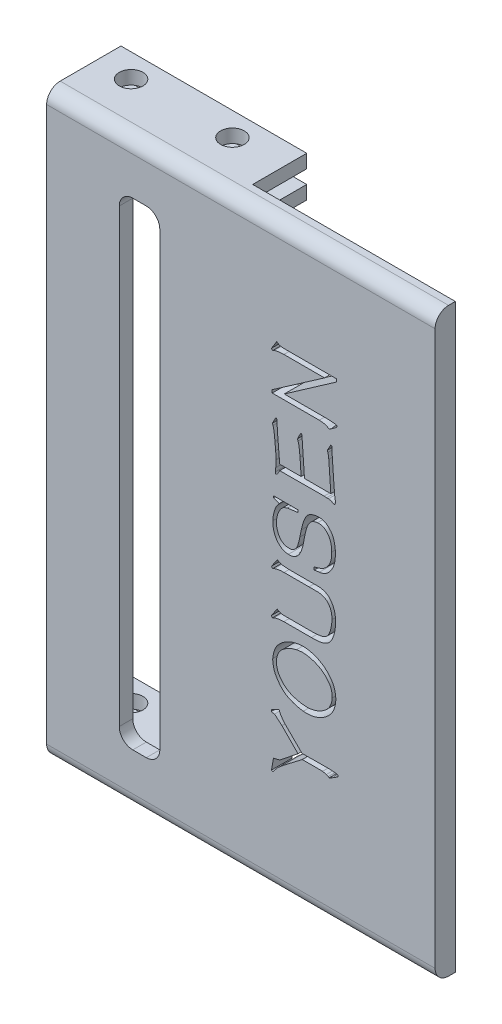
from build123d import *

# Parameters (mm, degrees)
SKETCH_1_W          = 30
SKETCH_1_H          = 11
EXTRUDE_1_DEPTH     = 6
SKETCH_2_W          = 16
SKETCH_2_H          = 2
CUT_EXTRUDE_1_DEPTH = 144
EXTRUDE_2_DEPTH     = 74
SKETCH_4_R          = 1.75
CUT_EXTRUDE_2_DEPTH = 144
SKETCH_5_W          = 11
SKETCH_5_H          = 80
CUT_EXTRUDE_3_DEPTH = 2.5
SKETCH_7_W          = 4
SKETCH_7_H          = 9
CUT_EXTRUDE_4_DEPTH = 74
SKETCH_8_W          = 3
SKETCH_8_H          = 86
EXTRUDE_3_DEPTH     = 30
SKETCH_9_W          = 6
SKETCH_9_H          = 70.729340398
CUT_EXTRUDE_5_DEPTH = 10
FILLET_1_R          = 2
FILLET_2_R          = 2
CUT_EXTRUDE_6_DEPTH = 10


with BuildPart() as part:
    # 草图1 → 凸台-拉伸1 (new body)
    with BuildSketch(Plane(origin=(0, 0, 0), x_dir=(1, 0, 0), z_dir=(0, 1, 0))):
        Rectangle(SKETCH_1_W, SKETCH_1_H)
    extrude_1 = extrude(amount=EXTRUDE_1_DEPTH)

    # 草图2 → 切除-拉伸1 (cut)
    with BuildSketch(Plane.ZY.offset(15)):
        with Locations((-5.5, 3)):
            Rectangle(SKETCH_2_W, SKETCH_2_H)
    cut_extrude_1 = extrude(amount=-CUT_EXTRUDE_1_DEPTH, mode=Mode.SUBTRACT)

    # 草图3 → 凸台-拉伸2 (add)
    with BuildSketch(Plane(origin=(0, 6, 0), x_dir=(1, 0, 0), z_dir=(0, 1, 0))):
        Polygon((2, 5.5), (-2, 5.5), (-2, -3.5), (-15, -3.5), (-15, -5.5), (15, -5.5), (15, -3.5), (2, -3.5), align=None)
    extrude(amount=EXTRUDE_2_DEPTH)

    # 草图4 → 切除-拉伸2 (cut)
    with BuildSketch(Plane(origin=(0, 6, 0), x_dir=(1, 0, 0), z_dir=(0, 1, 0))):
        with Locations(Location((-7.5, 2, 0), (0, 0, 270))):
            Circle(SKETCH_4_R)
        with Locations(Location((7.5, 2, 0), (0, 0, 270))):
            Circle(SKETCH_4_R)
    cut_extrude_2 = extrude(amount=-CUT_EXTRUDE_2_DEPTH, mode=Mode.SUBTRACT)

    # 草图5 → 切除-拉伸3 (cut)
    with BuildSketch(Plane.ZY.offset(15)):
        with Locations((0, 40)):
            Rectangle(SKETCH_5_W, SKETCH_5_H)
    cut_extrude_3 = extrude(amount=-CUT_EXTRUDE_3_DEPTH, mode=Mode.SUBTRACT)

    # 草图7 → 切除-拉伸4 (cut)
    with BuildSketch(Plane(origin=(0, 80, 0), x_dir=(1, 0, 0), z_dir=(0, 1, 0))):
        with Locations((0, 1)):
            Rectangle(SKETCH_7_W, SKETCH_7_H)
    extrude(amount=-CUT_EXTRUDE_4_DEPTH, mode=Mode.SUBTRACT)

    # 镜向1: 凸台-拉伸1, 切除-拉伸1, 切除-拉伸2, 切除-拉伸3 across plane
    add(extrude_1.mirror(Plane.ZX.offset(43)))
    add(cut_extrude_1.mirror(Plane.ZX.offset(43)), mode=Mode.SUBTRACT)
    add(cut_extrude_2.mirror(Plane.ZX.offset(43)), mode=Mode.SUBTRACT)
    add(cut_extrude_3.mirror(Plane.ZX.offset(43)), mode=Mode.SUBTRACT)

    # 草图8 → 凸台-拉伸3 (add)
    with BuildSketch(Plane(origin=(15, 0, 0), x_dir=(0, 0, -1), z_dir=(1, 0, 0))):
        with Locations((-4, 43)):
            Rectangle(SKETCH_8_W, SKETCH_8_H)
    extrude(amount=EXTRUDE_3_DEPTH)

    # 草图9 → 切除-拉伸5 (cut)
    with BuildSketch(Plane(origin=(0, 0, 3.5), x_dir=(-1, 0, 0), z_dir=(0, 0, -1))):
        with Locations((-1.25, 43)):
            Rectangle(SKETCH_9_W, SKETCH_9_H)
    extrude(amount=-CUT_EXTRUDE_5_DEPTH, mode=Mode.SUBTRACT)

    # 圆角1
    fillet_1_edges = [part.edges().sort_by_distance(p)[0] for p in [
        (-1.75, 78.364670199, 4.5),
        (-1.75, 7.635329801, 4.5),
        (4.25, 7.635329801, 4.5),
        (4.25, 78.364670199, 4.5),
    ]]
    fillet(fillet_1_edges, radius=FILLET_1_R)

    # 圆角2
    fillet_2_edges = [part.edges().sort_by_distance(p)[0] for p in [
        (16.25, 86, 5.5),
        (16.25, 0, 5.5),
    ]]
    fillet(fillet_2_edges, radius=FILLET_2_R)

    # 草图10 → 切除-拉伸6 (cut)
    # profile 1 of 6: a face of its own
    with BuildSketch(Plane.XY.offset(5.5)):
        with BuildLine():
            Line((20.923609631, 69.143191988), (20.793628809, 69.4010228))
            Line((20.793628809, 69.4010228), (21.556467079, 70.630513531))
            add(Edge.make_bspline(
                [(21.556467079, 70.630513531), (21.603258715, 70.603029141), (21.694098664, 70.549671729), (21.799421425, 70.469430592), (21.89359644, 70.413054973), (21.982189212, 70.381151779), (22.085649409, 70.349876431), (22.202564606, 70.329798704), (22.319704445, 70.310777676), (22.427850346, 70.298475626), (22.520839812, 70.288521589), (22.57853574, 70.28778512), (22.604836991, 70.287449393)],
                knots=[0, 0, 0, 0, 1.443959229, 2.80326126, 3.523689896, 4.356357707, 5.30232685, 6.400629209, 7.511085781, 8.463841558, 9.299727213, 10, 10, 10, 10], degree=3))
            Line((22.604836991, 70.287449393), (30.386639676, 70.287449393))
            Line((30.386639676, 70.287449393), (30.386639676, 69.859151928))
            Line((30.386639676, 69.859151928), (22.677285319, 64.47879821))
            Line((22.677285319, 64.47879821), (29.22107394, 64.47879821))
            add(Edge.make_bspline(
                [(29.22107394, 64.47879821), (29.27507082, 64.477751018), (29.390251433, 64.475517256), (29.574214632, 64.463787592), (29.779783322, 64.447725955), (29.993145343, 64.42176736), (30.189904536, 64.398780254), (30.338000195, 64.361532134), (30.440067424, 64.337626027), (30.495399702, 64.269623776), (30.469520021, 64.180561088), (30.422605432, 64.081599551), (30.323681546, 63.974210257), (30.236074262, 63.912777441), (30.186341359, 63.87790326)],
                knots=[0, 0, 0, 0, 1.071549029, 2.285718598, 3.657522067, 5.161076859, 6.556356206, 7.568412296, 8.220118684, 8.57247993, 9.168626842, 9.874616694, 10.793462406, 12, 12, 12, 12], degree=3))
            Line((30.186341359, 63.87790326), (29.53856808, 63.421904965))
            add(Edge.make_bspline(
                [(29.53856808, 63.421904965), (29.516064902, 63.40528111), (29.475640145, 63.375417982), (29.417803378, 63.338660651), (29.366609638, 63.320461394), (29.30241827, 63.316342516), (29.215965674, 63.358496474), (29.120434289, 63.411883293), (29.018056539, 63.468403182), (28.914067145, 63.516219277), (28.786848471, 63.560416777), (28.640199318, 63.610787332), (28.473060054, 63.656859807), (28.284186634, 63.684059238), (28.076554126, 63.704513048), (27.931271156, 63.706431975), (27.855209887, 63.707436608)],
                knots=[0, 0, 0, 0, 0.660040725, 1.185698533, 1.609414658, 1.928083271, 2.675051957, 3.799223021, 4.54110446, 5.425469141, 6.495824213, 7.714008071, 9.083117749, 10.575552166, 12.20716875, 14, 14, 14, 14], degree=3))
            Line((27.855209887, 63.707436608), (20.893777967, 63.707436608))
            Line((20.893777967, 63.707436608), (20.893777967, 64.135734072))
            Line((20.893777967, 64.135734072), (28.632963989, 69.51608779))
            Line((28.632963989, 69.51608779), (22.619752823, 69.51608779))
            add(Edge.make_bspline(
                [(22.619752823, 69.51608779), (22.501743733, 69.51440573), (22.26806127, 69.511074901), (21.98280487, 69.48000448), (21.770725587, 69.451735552), (21.635730493, 69.430421784), (21.523295711, 69.409773805), (21.403364307, 69.381874862), (21.269870229, 69.336304879), (21.172989666, 69.284501602), (21.123907948, 69.258256978)],
                knots=[0, 0, 0, 0, 1.848070468, 3.659562632, 4.490512658, 5.20034759, 5.80053293, 6.280969964, 7.129103451, 8, 8, 8, 8], degree=3))
            Line((21.123907948, 69.258256978), (20.923609631, 69.143191988))
        make_face()
    # profile 2 of 6: a face of its own
    with BuildSketch(Plane.XY.offset(5.5)):
        with BuildLine():
            Line((22.001811208, 55.139356488), (25.166098444, 55.139356488))
            Line((25.166098444, 55.139356488), (25.008416791, 57.542936288))
            add(Edge.make_bspline(
                [(25.008416791, 57.542936288), (25.002558438, 57.628926553), (24.989565663, 57.819637517), (24.957134615, 58.114856879), (24.924988635, 58.409963181), (24.887761037, 58.674981617), (24.847978287, 58.903533008), (24.808993318, 59.109462051), (24.764482166, 59.29388896), (24.724462089, 59.406261836), (24.705838483, 59.458555295)],
                knots=[0, 0, 0, 0, 1.063762447, 2.359234061, 3.665312484, 4.727882028, 5.66186734, 6.528447077, 7.315203139, 8, 8, 8, 8], degree=3))
            Line((24.705838483, 59.458555295), (24.633390156, 59.716386107))
            Line((24.633390156, 59.716386107), (25.051033454, 60.545280205))
            add(Edge.make_bspline(
                [(25.051033454, 60.545280205), (25.064088945, 60.566218188), (25.087028841, 60.603008471), (25.122036249, 60.646605882), (25.155045237, 60.672899051), (25.196687841, 60.676154178), (25.239497588, 60.644233412), (25.270576523, 60.583428234), (25.295123494, 60.500813222), (25.29573863, 60.437548045), (25.296079267, 60.402514383)],
                knots=[0, 0, 0, 0, 1.171677453, 2.05876289, 2.66801567, 3.108651998, 3.943333437, 5.003987974, 6.340931338, 8, 8, 8, 8], degree=3))
            Line((25.296079267, 60.402514383), (25.668975069, 55.139356488))
            Line((25.668975069, 55.139356488), (29.566268911, 55.139356488))
            Line((29.566268911, 55.139356488), (29.265821436, 59.4010228))
            add(Edge.make_bspline(
                [(29.265821436, 59.4010228), (29.260420022, 59.467912428), (29.249573754, 59.602229619), (29.21518963, 59.802228589), (29.176852109, 60.003542617), (29.139654948, 60.135679957), (29.120924782, 60.202216066)],
                knots=[0, 0, 0, 0, 0.986759393, 1.981454429, 2.983586542, 4, 4, 4, 4], degree=3))
            Line((29.120924782, 60.202216066), (29.048476454, 60.460046878))
            Line((29.048476454, 60.460046878), (29.495951417, 61.261240145))
            add(Edge.make_bspline(
                [(29.495951417, 61.261240145), (29.509053505, 61.281535774), (29.53202735, 61.317123126), (29.565856912, 61.357597529), (29.599543336, 61.382647363), (29.640382086, 61.373287532), (29.674616477, 61.345492844), (29.702140714, 61.309470024), (29.715775579, 61.269902247), (29.720441277, 61.223694141), (29.72484194, 61.161891008), (29.725636408, 61.114940295), (29.726081398, 61.088642659)],
                knots=[0, 0, 0, 0, 1.417098271, 2.484809728, 3.160089746, 3.710923159, 4.791695792, 5.721562469, 6.344139884, 7.232529516, 8.449907881, 10, 10, 10, 10], degree=3))
            Line((29.726081398, 61.088642659), (29.738866397, 60.660345195))
            add(Edge.make_bspline(
                [(29.738866397, 60.660345195), (29.744301179, 60.539585557), (29.755909219, 60.281657515), (29.779914759, 59.868997791), (29.810277532, 59.405973817), (29.843903673, 58.890940109), (29.884568254, 58.325564053), (29.931478815, 57.709039992), (29.985382372, 57.04219428), (30.022302736, 56.580512758), (30.041444705, 56.341146388)],
                knots=[0, 0, 0, 0, 0.67000843, 1.431057303, 2.291062776, 3.241936932, 4.291812217, 5.432859302, 6.669023727, 8, 8, 8, 8], degree=3))
            Line((30.041444705, 56.341146388), (30.156509695, 55.024291498))
            add(Edge.make_bspline(
                [(30.156509695, 55.024291498), (30.167312854, 54.969630642), (30.187760774, 54.866170083), (30.214542098, 54.718684561), (30.230907581, 54.5869295), (30.245734442, 54.440298814), (30.246602713, 54.28267474), (30.203106798, 54.148064595), (30.149553988, 54.067545672), (30.091556481, 54.038052311), (30.024766425, 54.028399505), (29.980127332, 54.042790558), (29.956211379, 54.050500746)],
                knots=[0, 0, 0, 0, 1.415592265, 2.679393981, 3.807465703, 4.786069614, 6.429066349, 7.764404185, 8.331032004, 8.823567541, 9.369711548, 10, 10, 10, 10], degree=3))
            add(Edge.make_bspline(
                [(29.956211379, 54.050500746), (29.93965655, 54.056444449), (29.890339913, 54.07415067), (29.811045465, 54.128205528), (29.708744803, 54.192376954), (29.579957763, 54.244101588), (29.416716209, 54.283596122), (29.293071612, 54.299228751), (29.22107394, 54.308331558)],
                knots=[0, 0, 0, 0, 0.400502326, 1.193091618, 2.174787829, 3.156484041, 4.344233903, 6, 6, 6, 6], degree=3))
            Line((29.22107394, 54.308331558), (28.948327296, 54.308331558))
            add(Edge.make_bspline(
                [(28.948327296, 54.308331558), (28.908539042, 54.31244042), (28.835359752, 54.319997515), (28.736178254, 54.332363266), (28.65571391, 54.335953009), (28.608814028, 54.337488752), (28.588216493, 54.338163222)],
                knots=[0, 0, 0, 0, 1.327867894, 2.442239059, 3.315861034, 4, 4, 4, 4], degree=3))
            Line((28.588216493, 54.338163222), (22.001811208, 54.308331558))
            add(Edge.make_bspline(
                [(22.001811208, 54.308331558), (21.968452861, 54.251493204), (21.901243824, 54.136977604), (21.804065964, 53.972419745), (21.716401896, 53.827663172), (21.642541534, 53.716612644), (21.578975732, 53.639909011), (21.509504489, 53.603111582), (21.450672022, 53.601695497), (21.399696481, 53.597643049), (21.37359306, 53.634309729), (21.367516052, 53.684382469), (21.362742814, 53.758519583), (21.366691303, 53.816805177), (21.368953761, 53.850202429)],
                knots=[0, 0, 0, 0, 1.929088606, 3.8866491, 5.594679263, 6.880700987, 7.792666375, 8.490018427, 9.075498901, 9.557743041, 9.823998025, 10.293064845, 11.021937678, 12, 12, 12, 12], degree=3))
            Line((21.368953761, 53.850202429), (21.411570424, 54.395695717))
            add(Edge.make_bspline(
                [(21.411570424, 54.395695717), (21.41591824, 54.458905652), (21.424124318, 54.578208226), (21.434357361, 54.745851724), (21.444130983, 54.892094522), (21.448375503, 55.049097301), (21.45347358, 55.205594289), (21.444951931, 55.319786754), (21.441402088, 55.367355636)],
                knots=[0, 0, 0, 0, 1.172075672, 2.212178238, 3.107213123, 3.882892712, 5.118081668, 6, 6, 6, 6], degree=3))
            Line((21.441402088, 55.367355636), (21.441402088, 55.452588962))
            add(Edge.make_bspline(
                [(21.441402088, 55.452588962), (21.441050192, 55.561268252), (21.440385429, 55.766572791), (21.433965929, 56.059245176), (21.42356146, 56.323207524), (21.405350341, 56.489663399), (21.396654592, 56.569145536)],
                knots=[0, 0, 0, 0, 1.166357934, 2.203350603, 3.142105787, 4, 4, 4, 4], degree=3))
            Line((21.396654592, 56.569145536), (21.296505434, 57.68570211))
            add(Edge.make_bspline(
                [(21.296505434, 57.68570211), (21.292335326, 57.743951906), (21.284399666, 57.854800482), (21.271800378, 58.011082266), (21.25929242, 58.148211111), (21.240754929, 58.309994905), (21.220548585, 58.516651707), (21.181187841, 58.772598868), (21.142950324, 59.029707156), (21.096905838, 59.259338942), (21.058879546, 59.447751455), (21.023818061, 59.555360318), (21.008842958, 59.601321117)],
                knots=[0, 0, 0, 0, 0.902698862, 1.717823745, 2.423571822, 3.031008779, 4.234968865, 5.632389185, 7.033083569, 8.251820998, 9.253335651, 10, 10, 10, 10], degree=3))
            Line((21.008842958, 59.601321117), (20.923609631, 59.859151928))
            Line((20.923609631, 59.859151928), (21.354037929, 60.688046026))
            add(Edge.make_bspline(
                [(21.354037929, 60.688046026), (21.367092961, 60.705469869), (21.39040149, 60.736578499), (21.426583036, 60.772737787), (21.455806248, 60.796345395), (21.48986503, 60.807599967), (21.53300314, 60.784468782), (21.557743841, 60.724257521), (21.583640213, 60.643933662), (21.583979839, 60.580440252), (21.58416791, 60.545280205)],
                knots=[0, 0, 0, 0, 1.104947442, 1.972779611, 2.593816905, 3.005386707, 3.716416319, 4.799929555, 6.227932149, 8, 8, 8, 8], degree=3))
            Line((21.58416791, 60.545280205), (21.613999574, 60.089281909))
            add(Edge.make_bspline(
                [(21.613999574, 60.089281909), (21.619959672, 59.990524192), (21.63115419, 59.805033118), (21.653264781, 59.545407329), (21.662931911, 59.322043253), (21.678613954, 59.135508573), (21.683948174, 58.985358734), (21.69605164, 58.872030034), (21.6961133, 58.795114728), (21.698431533, 58.756086602), (21.6992329, 58.742595355)],
                knots=[0, 0, 0, 0, 1.759547492, 3.304859231, 4.633400162, 5.73500885, 6.633314684, 7.304723391, 7.759656695, 8, 8, 8, 8], degree=3))
            Line((21.6992329, 58.742595355), (22.001811208, 55.139356488))
        make_face()
    # profile 3 of 6: a face of its own
    with BuildSketch(Plane.XY.offset(5.5)):
        with BuildLine():
            Line((21.944278713, 50.063711911), (21.066375453, 50.351374387))
            Line((21.066375453, 50.351374387), (21.081291285, 50.63690603))
            Line((21.081291285, 50.63690603), (24.676006819, 50.63690603))
            Line((24.676006819, 50.63690603), (24.690922651, 50.293841892))
            Line((24.690922651, 50.293841892), (23.167376944, 50.093543576))
            add(Edge.make_bspline(
                [(23.167376944, 50.093543576), (23.082393821, 50.065706597), (22.923913881, 50.013795082), (22.709564926, 49.922700147), (22.535427697, 49.827888071), (22.395527644, 49.726597864), (22.284296585, 49.610388962), (22.176519077, 49.487279048), (22.074472717, 49.345678645), (21.977511216, 49.187702831), (21.882371067, 49.016379659), (21.800967235, 48.825955873), (21.72037137, 48.622480929), (21.631639981, 48.326573751), (21.543833252, 47.938809117), (21.522471224, 47.620194511), (21.511719582, 47.459833795)],
                knots=[0, 0, 0, 0, 1.121549844, 2.091511183, 2.917185958, 3.605104007, 4.247789873, 4.930145152, 5.657339825, 6.433750816, 7.25513509, 8.112836821, 9.029603893, 9.999196791, 11.986370824, 14, 14, 14, 14], degree=3))
            add(Edge.make_bspline(
                [(21.511719582, 47.459833795), (21.514107539, 47.363198237), (21.518948639, 47.167289097), (21.543385267, 46.918359138), (21.585726913, 46.708968566), (21.635719776, 46.534081562), (21.702345872, 46.342963403), (21.781970854, 46.140766984), (21.879478494, 45.944009907), (21.988077265, 45.762246566), (22.10874723, 45.604716291), (22.240033727, 45.471323513), (22.376635932, 45.361303244), (22.51281973, 45.269275073), (22.647955435, 45.195316782), (22.786108408, 45.140312699), (22.934505821, 45.102102752), (23.097522436, 45.072081631), (23.280800255, 45.055493691), (23.47748111, 45.0386374), (23.684414105, 45.050019003), (23.886401585, 45.112323701), (24.078580743, 45.218692968), (24.188537084, 45.319382931), (24.245578521, 45.371617302)],
                knots=[0, 0, 0, 0, 1.459173037, 2.958179576, 3.76774155, 4.680873248, 5.701489889, 6.82243581, 7.958863455, 9.012511816, 10.014026446, 10.946591305, 11.830747586, 12.657452482, 13.425028708, 14.151753666, 14.895598774, 15.734725641, 16.65118754, 17.671804181, 18.714539863, 19.755896519, 20.835838952, 22, 22, 22, 22], degree=3))
            add(Edge.make_bspline(
                [(24.245578521, 45.371617302), (24.301744128, 45.43243705), (24.41607532, 45.556242252), (24.550376956, 45.779239287), (24.667732875, 46.026846478), (24.750460904, 46.300908539), (24.821819345, 46.574754085), (24.883205511, 46.834500533), (24.937985242, 47.069027869), (24.965608525, 47.21894194), (24.978585127, 47.289367143)],
                knots=[0, 0, 0, 0, 0.951320796, 1.936516809, 2.983378994, 4.101119546, 5.226321135, 6.244331444, 7.175238766, 8, 8, 8, 8], degree=3))
            Line((24.978585127, 47.289367143), (25.181014277, 48.290858726))
            add(Edge.make_bspline(
                [(25.181014277, 48.290858726), (25.209510455, 48.413890714), (25.264014204, 48.649210152), (25.352051043, 48.984383674), (25.437427958, 49.286508312), (25.527939908, 49.555682141), (25.620813055, 49.79716816), (25.714577402, 50.016946161), (25.818214396, 50.212768679), (25.922186499, 50.390277156), (26.034619318, 50.5474125), (26.159516935, 50.682053603), (26.292101205, 50.799327673), (26.484399809, 50.926053227), (26.742427599, 51.051325024), (27.076092808, 51.159865207), (27.439261269, 51.226223811), (27.761514918, 51.25323462), (28.030940179, 51.251147653), (28.2327959, 51.221436579), (28.430831805, 51.174995432), (28.555467489, 51.121763419), (28.618048157, 51.095035159)],
                knots=[0, 0, 0, 0, 1.450366521, 2.774070724, 3.97977706, 5.055505924, 6.034186978, 6.951116498, 7.797628348, 8.576887578, 9.312796996, 10.011361253, 10.682077562, 11.340476915, 12.6502067, 13.963285664, 15.35841222, 16.880662764, 17.672123816, 18.446242192, 19.219844604, 20, 20, 20, 20], degree=3))
            add(Edge.make_bspline(
                [(28.618048157, 51.095035159), (28.684268101, 51.064698195), (28.817386349, 51.003713495), (29.001707653, 50.882317607), (29.177196092, 50.742467897), (29.337234552, 50.582134401), (29.483747618, 50.413084791), (29.617642735, 50.245396293), (29.730032669, 50.076296191), (29.829421172, 49.906395756), (29.914921915, 49.723152742), (29.990981794, 49.517733673), (30.060185259, 49.285464444), (30.12478039, 49.027739104), (30.176559273, 48.745904255), (30.218983513, 48.441854547), (30.237874119, 48.115657648), (30.241833385, 47.890985439), (30.243873855, 47.775197102)],
                knots=[0, 0, 0, 0, 0.891741816, 1.792618663, 2.696897356, 3.638912313, 4.564486665, 5.438886447, 6.267203075, 7.051274704, 7.849765819, 8.742484793, 9.734097487, 10.819551853, 11.997873062, 13.245295847, 14.580320138, 16, 16, 16, 16], degree=3))
            add(Edge.make_bspline(
                [(30.243873855, 47.775197102), (30.24339063, 47.645174408), (30.242449153, 47.391848827), (30.213615347, 47.021846124), (30.155452214, 46.673696146), (30.075031256, 46.346577587), (29.971365197, 46.041150165), (29.853471246, 45.75437828), (29.713318017, 45.488301565), (29.557405273, 45.242422508), (29.384264405, 45.018908126), (29.194433857, 44.821234972), (28.985957416, 44.652461261), (28.766023249, 44.509884374), (28.53880703, 44.398637136), (28.313779065, 44.311918516), (28.091558985, 44.252229762), (27.942878881, 44.235531034), (27.870125719, 44.227359898)],
                knots=[0, 0, 0, 0, 1.328708624, 2.588747203, 3.788207092, 4.932691089, 6.027755457, 7.082091847, 8.098479613, 9.097371676, 10.054362371, 10.983635839, 11.891827449, 12.789952854, 13.656814164, 14.47252458, 15.252565316, 16, 16, 16, 16], degree=3))
            Line((27.870125719, 44.227359898), (27.107287449, 44.11442574))
            Line((27.107287449, 44.11442574), (27.107287449, 44.512891541))
            add(Edge.make_bspline(
                [(27.107287449, 44.512891541), (27.197618168, 44.536574991), (27.372514296, 44.582430309), (27.623586016, 44.656377581), (27.853952023, 44.734109394), (28.067910231, 44.809855916), (28.266480793, 44.894748787), (28.450889822, 44.995915965), (28.623233364, 45.110920335), (28.786059047, 45.240353243), (28.936797088, 45.387837737), (29.079178946, 45.553098736), (29.208618918, 45.739364885), (29.326381299, 45.943008161), (29.432517634, 46.156479344), (29.517324681, 46.378186901), (29.586918612, 46.602086871), (29.649364505, 46.903335914), (29.696791705, 47.275765223), (29.696427616, 47.572627426), (29.696249734, 47.717664607)],
                knots=[0, 0, 0, 0, 1.10367521, 2.136908949, 3.092581466, 3.976901347, 4.819056112, 5.641782223, 6.459007961, 7.265295195, 8.0964156, 8.947766784, 9.839743601, 10.772729839, 11.726335396, 12.653905287, 13.575377191, 14.494130149, 16.287146445, 18, 18, 18, 18], degree=3))
            add(Edge.make_bspline(
                [(29.696249734, 47.717664607), (29.693886127, 47.845614732), (29.689358676, 48.09070122), (29.652839941, 48.441214442), (29.595489285, 48.758618439), (29.509172179, 49.043140353), (29.401314546, 49.298362783), (29.278261453, 49.53074598), (29.134755875, 49.738413139), (28.976259262, 49.920264977), (28.81025625, 50.073424795), (28.650612866, 50.20403976), (28.490274709, 50.298725261), (28.332990325, 50.367837856), (28.16964573, 50.410781674), (27.99593935, 50.435140983), (27.807672178, 50.446683353), (27.677634063, 50.440049614), (27.610164074, 50.436607714)],
                knots=[0, 0, 0, 0, 1.577169719, 3.021044242, 4.340099201, 5.547956709, 6.678312898, 7.751845845, 8.784229068, 9.783508512, 10.719053536, 11.567010056, 12.320942599, 13.007419184, 13.678702228, 14.395776558, 15.167652216, 16, 16, 16, 16], degree=3))
            add(Edge.make_bspline(
                [(27.610164074, 50.436607714), (27.504483027, 50.420109382), (27.305268269, 50.389009092), (27.030959637, 50.304321298), (26.800240889, 50.19010999), (26.613243125, 50.041979768), (26.461637332, 49.86789839), (26.324122111, 49.677630873), (26.203091997, 49.464732238), (26.093375084, 49.229613765), (25.994664397, 48.965035102), (25.905228848, 48.666863818), (25.816691381, 48.33392238), (25.767282924, 48.09863877), (25.741423397, 47.975495419)],
                knots=[0, 0, 0, 0, 1.145165536, 2.158701882, 3.06423871, 3.88809188, 4.696610927, 5.531051165, 6.40061699, 7.316650749, 8.309130531, 9.423940214, 10.651735088, 12, 12, 12, 12], degree=3))
            Line((25.741423397, 47.975495419), (25.511293416, 46.746004688))
            add(Edge.make_bspline(
                [(25.511293416, 46.746004688), (25.491452438, 46.647823708), (25.452603666, 46.455584671), (25.382709548, 46.175797236), (25.300830711, 45.911047744), (25.212922601, 45.660821734), (25.115281863, 45.428589292), (25.00939884, 45.21613892), (24.891879579, 45.026124343), (24.766208485, 44.856651259), (24.630240994, 44.706992097), (24.482597069, 44.576841857), (24.323650204, 44.46296768), (24.152948077, 44.365179321), (23.963567634, 44.29170664), (23.755021863, 44.243114844), (23.525137425, 44.219657079), (23.365576294, 44.224721328), (23.282441935, 44.227359898)],
                knots=[0, 0, 0, 0, 1.289640996, 2.525125968, 3.711219748, 4.856705847, 5.938696513, 6.953019439, 7.909847173, 8.811592377, 9.666094516, 10.508371953, 11.340810705, 12.180253271, 13.034510673, 13.946218176, 14.929940919, 16, 16, 16, 16], degree=3))
            add(Edge.make_bspline(
                [(23.282441935, 44.227359898), (23.210593342, 44.229425615), (23.071220877, 44.23343271), (22.869731458, 44.263742918), (22.682957062, 44.312290835), (22.50974047, 44.381202991), (22.349008435, 44.471325567), (22.191921695, 44.574065743), (22.039274417, 44.693698936), (21.841439935, 44.871089026), (21.621434539, 45.120743102), (21.399121528, 45.456070106), (21.231299676, 45.835320693), (21.114223925, 46.180150336), (21.044063784, 46.490572534), (21.006733782, 46.758476498), (20.986602777, 47.056797631), (20.983022111, 47.265187781), (20.981142127, 47.374600469)],
                knots=[0, 0, 0, 0, 0.794834547, 1.541826297, 2.249141067, 2.926381412, 3.598218035, 4.284925032, 5.001869476, 5.742090078, 7.223157112, 8.670703721, 10.175975165, 11.799046215, 12.693363536, 13.693781192, 14.789148147, 16, 16, 16, 16], degree=3))
            add(Edge.make_bspline(
                [(20.981142127, 47.374600469), (20.988063287, 47.496906526), (21.001666446, 47.737292365), (21.04934599, 48.091189061), (21.118905554, 48.432502063), (21.212153124, 48.755705162), (21.317885478, 49.052399523), (21.425625309, 49.314766842), (21.542855527, 49.53503451), (21.630654712, 49.661683028), (21.671532069, 49.720647773)],
                knots=[0, 0, 0, 0, 1.186644948, 2.332285491, 3.456642158, 4.558939002, 5.588560713, 6.507634021, 7.305187447, 8, 8, 8, 8], degree=3))
            Line((21.671532069, 49.720647773), (21.944278713, 50.063711911))
        make_face()
    # profile 4 of 6: a face of its own
    with BuildSketch(Plane.XY.offset(5.5)):
        with BuildLine():
            add(Edge.make_bspline(
                [(21.613999574, 36.370978052), (21.662360444, 36.344828089), (21.750408249, 36.297218382), (21.879220649, 36.225165987), (22.01975306, 36.163869919), (22.157877796, 36.116056219), (22.299961114, 36.086359273), (22.43967835, 36.070466132), (22.606818367, 36.060249807), (22.727697349, 36.058618236), (22.792350309, 36.057745579)],
                knots=[0, 0, 0, 0, 1.064381522, 1.9378571, 2.855038404, 4.028959621, 4.759735853, 5.660172601, 6.748527116, 8, 8, 8, 8], degree=3))
            Line((22.792350309, 36.057745579), (26.719475815, 36.057745579))
            add(Edge.make_bspline(
                [(26.719475815, 36.057745579), (26.870795334, 36.060042998), (27.159498807, 36.064426259), (27.572381544, 36.090308406), (27.943782178, 36.139721104), (28.276437064, 36.203844323), (28.5691486, 36.300114666), (28.819703505, 36.435274359), (29.02831924, 36.610052379), (29.185455143, 36.828027051), (29.310638992, 37.069354531), (29.422708081, 37.328387894), (29.515221215, 37.607467478), (29.590845641, 37.901032724), (29.648510221, 38.200280789), (29.694392801, 38.494307972), (29.720864526, 38.780459651), (29.724357807, 38.967703226), (29.726081398, 39.060089495)],
                knots=[0, 0, 0, 0, 1.449427381, 2.76537172, 3.959381382, 5.036075724, 6.006325128, 6.898367935, 7.747674675, 8.58852031, 9.452896528, 10.348847792, 11.288960252, 12.265769967, 13.250389659, 14.206730454, 15.115198046, 16, 16, 16, 16], degree=3))
            add(Edge.make_bspline(
                [(29.726081398, 39.060089495), (29.725452192, 39.196618975), (29.724254922, 39.456410753), (29.677085719, 39.82601129), (29.59665469, 40.155968549), (29.475191696, 40.44142229), (29.336393393, 40.686936448), (29.189939161, 40.893872579), (29.039378951, 41.065616556), (28.826364859, 41.22782236), (28.558294605, 41.379923937), (28.232702701, 41.495461112), (27.924978879, 41.562737173), (27.699209007, 41.579711768), (27.544819982, 41.578565474), (27.442537993, 41.578796817), (27.316819565, 41.578712429), (27.166950714, 41.578741725), (26.99222248, 41.578731823), (26.793344691, 41.578735059), (26.570317496, 41.578734056), (26.414056397, 41.578734206), (26.331664181, 41.578734285)],
                knots=[0, 0, 0, 0, 1.636289578, 3.113573577, 4.458730225, 5.696017665, 6.821424215, 7.835561263, 8.734151577, 9.547123498, 11.03498204, 12.412106263, 13.675343255, 14.80313353, 15.1183533, 15.527287055, 16.029934795, 16.626296521, 17.324891686, 18.12572029, 19.011743425, 20, 20, 20, 20], degree=3))
            Line((26.331664181, 41.578734285), (22.634668655, 41.578734285))
            add(Edge.make_bspline(
                [(22.634668655, 41.578734285), (22.523794377, 41.578257135), (22.319503743, 41.577377966), (22.031414923, 41.55229818), (21.769224812, 41.515025986), (21.56403453, 41.461522823), (21.409475932, 41.417521612), (21.311407305, 41.384811454), (21.231709683, 41.354957914), (21.186247697, 41.331207346), (21.166524611, 41.320903473)],
                knots=[0, 0, 0, 0, 1.769940813, 3.26119218, 4.61523004, 5.993615172, 6.643381153, 7.181459001, 7.644886738, 8, 8, 8, 8], degree=3))
            Line((21.166524611, 41.320903473), (20.93639463, 41.205838483))
            Line((20.93639463, 41.205838483), (20.793628809, 41.463669295))
            Line((20.793628809, 41.463669295), (21.656616237, 42.72299169))
            add(Edge.make_bspline(
                [(21.656616237, 42.72299169), (21.704653727, 42.689321162), (21.790763109, 42.628965213), (21.920711346, 42.544534264), (22.072346237, 42.488253113), (22.253782256, 42.431069125), (22.471648554, 42.388240759), (22.627364675, 42.382743205), (22.707116983, 42.379927552)],
                knots=[0, 0, 0, 0, 0.938611257, 1.682503285, 2.466890065, 3.51208826, 4.725779319, 6, 6, 6, 6], degree=3))
            Line((22.707116983, 42.379927552), (23.382591093, 42.322395056))
            Line((23.382591093, 42.322395056), (26.804709141, 42.322395056))
            add(Edge.make_bspline(
                [(26.804709141, 42.322395056), (26.893493804, 42.322376976), (27.062539802, 42.322342551), (27.301193774, 42.322571555), (27.512144204, 42.321857595), (27.759640724, 42.324800443), (28.063523139, 42.303159736), (28.367075875, 42.242788604), (28.614140962, 42.164958304), (28.799936281, 42.086829784), (28.97930985, 41.984732193), (29.156264418, 41.864933107), (29.330208727, 41.718056187), (29.495060863, 41.535542441), (29.654766589, 41.319514198), (29.811512956, 41.076538715), (29.9507045, 40.804802585), (30.069415058, 40.513280082), (30.155185008, 40.20094819), (30.217942518, 39.878039636), (30.256089772, 39.55441636), (30.280111665, 39.24236949), (30.288716193, 38.945559125), (30.277190821, 38.753217809), (30.271574686, 38.659492862)],
                knots=[0, 0, 0, 0, 0.981690724, 1.869139139, 2.638784667, 3.314187885, 4.605609402, 5.999494082, 6.724744972, 7.467225126, 8.223165231, 9.003000965, 9.827583775, 10.733602945, 11.71529367, 12.795888592, 13.926905378, 15.086304982, 16.269714318, 17.501892221, 18.720505373, 19.870369906, 20.962264212, 22, 22, 22, 22], degree=3))
            add(Edge.make_bspline(
                [(30.271574686, 38.659492862), (30.260976183, 38.516490604), (30.239731919, 38.229848434), (30.168016403, 37.80227307), (30.0624947, 37.376656301), (29.94990526, 37.026910268), (29.841771482, 36.757745615), (29.757700301, 36.568634453), (29.663673902, 36.397129121), (29.56564594, 36.239910266), (29.460946144, 36.098790946), (29.350676617, 35.972371175), (29.232523427, 35.862753942), (29.067698584, 35.738791276), (28.848917642, 35.610087774), (28.57236898, 35.484137716), (28.277479926, 35.395085275), (27.863849627, 35.319043978), (27.332225361, 35.270292796), (26.904231857, 35.261140898), (26.689644151, 35.256552312)],
                knots=[0, 0, 0, 0, 1.354316437, 2.71467185, 4.090057815, 5.494990513, 6.18165123, 6.830369334, 7.448987134, 8.028044985, 8.579698719, 9.10748665, 9.610859129, 10.099429963, 11.053554338, 12.002756855, 12.964404133, 13.955481319, 15.972156172, 18, 18, 18, 18], degree=3))
            Line((26.689644151, 35.256552312), (22.604836991, 35.256552312))
            add(Edge.make_bspline(
                [(22.604836991, 35.256552312), (22.496037773, 35.255108884), (22.289207224, 35.252364884), (21.994838789, 35.21568934), (21.727554579, 35.167029546), (21.520785909, 35.123820912), (21.371412738, 35.085470839), (21.277986791, 35.0598492), (21.202635543, 35.028979707), (21.158634341, 35.008115255), (21.13882378, 34.9987215)],
                knots=[0, 0, 0, 0, 1.742805985, 3.313125987, 4.74688916, 6.097849436, 6.697041034, 7.219379344, 7.648542933, 8, 8, 8, 8], degree=3))
            Line((21.13882378, 34.9987215), (20.908693799, 34.88365651))
            Line((20.908693799, 34.88365651), (20.763797145, 35.113786491))
            Line((20.763797145, 35.113786491), (21.613999574, 36.370978052))
        make_face()
    # profile 5 of 6: a face of its own
    with BuildSketch(Plane.XY.offset(5.5)):
        with BuildLine():
            add(Edge.make_bspline(
                [(25.481461752, 25.207543149), (25.343344313, 25.226229112), (25.057445102, 25.264908528), (24.620442056, 25.363027299), (24.161285003, 25.496772631), (23.768153784, 25.633029366), (23.449319825, 25.762156538), (23.218087611, 25.881220036), (22.992453943, 26.009436652), (22.780271304, 26.159414494), (22.571793729, 26.316602024), (22.378435864, 26.496763936), (22.190215314, 26.687074754), (22.01552102, 26.892912349), (21.85460977, 27.103871268), (21.704488038, 27.310733321), (21.569502704, 27.512550717), (21.453096543, 27.711179562), (21.349160483, 27.902763126), (21.264081833, 28.09112868), (21.193384868, 28.273916865), (21.120953974, 28.507088675), (21.056291243, 28.787489721), (21.000976995, 29.109092133), (20.964856206, 29.410846259), (20.965780605, 29.605492626), (20.966226294, 29.699339442)],
                knots=[0, 0, 0, 0, 1.429604005, 2.959240058, 4.590035967, 6.334881075, 7.226834275, 8.11664106, 9.001659397, 9.887127752, 10.780746821, 11.678398701, 12.595775118, 13.526202133, 14.446036032, 15.317841917, 16.148622975, 16.936076622, 17.679464246, 18.383965174, 19.055302938, 19.689201287, 20.887736004, 22.004435846, 23.037858538, 24, 24, 24, 24], degree=3))
            add(Edge.make_bspline(
                [(20.966226294, 29.699339442), (20.973982222, 29.789024836), (20.990204949, 29.976615746), (21.046069861, 30.266927264), (21.125934897, 30.578254931), (21.227072429, 30.90605569), (21.358610514, 31.234423332), (21.532253237, 31.543135237), (21.734363058, 31.832135587), (21.974591495, 32.09122817), (22.233740203, 32.327501958), (22.50336203, 32.544116031), (22.781256111, 32.737916167), (23.070806836, 32.908142982), (23.372470726, 33.058321605), (23.690837407, 33.187107021), (24.024657928, 33.301636766), (24.373807586, 33.393272086), (24.729740319, 33.467251123), (25.088277178, 33.508894856), (25.444620742, 33.526407235), (25.681080454, 33.512126447), (25.798955892, 33.505007458)],
                knots=[0, 0, 0, 0, 0.788473871, 1.649215377, 2.586748967, 3.604575536, 4.654169078, 5.679562107, 6.702022434, 7.737511617, 8.768406812, 9.773592413, 10.766463969, 11.734737828, 12.714626775, 13.716820544, 14.7423836, 15.805347833, 16.878397755, 17.925348482, 18.965783837, 20, 20, 20, 20], degree=3))
            add(Edge.make_bspline(
                [(25.798955892, 33.505007458), (25.888573569, 33.49759137), (26.073528212, 33.482285908), (26.359105719, 33.43641915), (26.660456152, 33.367469211), (26.977206157, 33.278080701), (27.30334354, 33.167759497), (27.630882264, 33.024915986), (27.958179219, 32.856793835), (28.28407812, 32.662912009), (28.603689321, 32.444345196), (28.904232, 32.189795304), (29.190713207, 31.911332267), (29.454541685, 31.605881137), (29.693074304, 31.285227359), (29.888129071, 30.947201999), (30.043633692, 30.601384677), (30.151713902, 30.249422256), (30.224684781, 29.907572713), (30.281595185, 29.588191361), (30.305706727, 29.292017205), (30.30279803, 29.103437884), (30.30140635, 29.013211166)],
                knots=[0, 0, 0, 0, 0.768858673, 1.586784955, 2.471004772, 3.411386059, 4.400720112, 5.412914909, 6.464306312, 7.545681452, 8.654452018, 9.771330006, 10.909675167, 12.068007478, 13.219822741, 14.322151472, 15.39904715, 16.455742323, 17.463827502, 18.387581077, 19.228530106, 20, 20, 20, 20], degree=3))
            add(Edge.make_bspline(
                [(30.30140635, 29.013211166), (30.295859121, 28.919299618), (30.284373286, 28.724850709), (30.235295129, 28.424925911), (30.159809109, 28.107647062), (30.059989282, 27.776386657), (29.926689732, 27.441984878), (29.745426244, 27.121592073), (29.524054157, 26.815492511), (29.260431001, 26.53241885), (28.96893968, 26.268652006), (28.655693955, 26.030339503), (28.323171883, 25.817343714), (27.975353725, 25.635938968), (27.625728591, 25.48023696), (27.28093569, 25.361094755), (26.948033814, 25.271364852), (26.62503744, 25.218974211), (26.316445397, 25.193424461), (26.023588885, 25.179295933), (25.746577131, 25.182124681), (25.568040279, 25.19924226), (25.481461752, 25.207543149)],
                knots=[0, 0, 0, 0, 0.818957227, 1.695694972, 2.64257219, 3.658231732, 4.707111611, 5.770684912, 6.855934216, 7.989954177, 9.133117169, 10.276414071, 11.414224526, 12.568200527, 13.690073075, 14.744629894, 15.742498148, 16.689375365, 17.590015015, 18.438377131, 19.242716525, 20, 20, 20, 20], degree=3))
        make_face()
        with BuildLine():
            add(Edge.make_bspline(
                [(25.511293416, 26.03856808), (25.582245954, 26.030550299), (25.731615819, 26.0136712), (25.968010972, 26.0062612), (26.227571697, 26.013612391), (26.508140961, 26.033704617), (26.804098562, 26.075437982), (27.108406311, 26.144358049), (27.417593767, 26.240597224), (27.728228051, 26.364308578), (28.034488064, 26.508148227), (28.325796997, 26.678492876), (28.601237741, 26.867225036), (28.855621585, 27.077662782), (29.086115032, 27.302138781), (29.27859363, 27.544946021), (29.43794591, 27.798344436), (29.553748815, 28.063827871), (29.641849995, 28.326580089), (29.708029191, 28.577145427), (29.753584086, 28.813523797), (29.763776593, 28.966869015), (29.768698061, 29.040911997)],
                knots=[0, 0, 0, 0, 0.735097118, 1.547532474, 2.432857713, 3.408430776, 4.44285583, 5.507560147, 6.618062538, 7.773960216, 8.948522421, 10.098945399, 11.245291865, 12.383182934, 13.495201895, 14.551860885, 15.566784221, 16.568655726, 17.526267422, 18.418665143, 19.236449953, 20, 20, 20, 20], degree=3))
            add(Edge.make_bspline(
                [(29.768698061, 29.040911997), (29.771040812, 29.11908393), (29.775841943, 29.279286076), (29.751565926, 29.525136619), (29.70980054, 29.781984785), (29.641369981, 30.047639077), (29.5453879, 30.320236259), (29.403332343, 30.590238568), (29.224095614, 30.858785795), (29.006600057, 31.118936535), (28.769147601, 31.368643732), (28.513512437, 31.595128327), (28.249625025, 31.79895339), (27.973126955, 31.975474634), (27.690656472, 32.130205171), (27.403219846, 32.265601888), (27.11133653, 32.380768567), (26.816731766, 32.475052647), (26.525882809, 32.553894836), (26.243533658, 32.615776482), (25.971041192, 32.660553294), (25.703889622, 32.69231985), (25.428063542, 32.704452164), (25.132678762, 32.686182295), (24.811519335, 32.651379143), (24.59054377, 32.610166396), (24.475708502, 32.588749201)],
                knots=[0, 0, 0, 0, 0.77580307, 1.589896916, 2.447866163, 3.357852643, 4.310457512, 5.310341687, 6.378318515, 7.510672779, 8.672875156, 9.796786547, 10.898439177, 11.980251257, 13.050228784, 14.094493645, 15.133027303, 16.163411326, 17.164215324, 18.124231549, 19.032056505, 19.905110502, 20.79442031, 21.768911572, 22.84056123, 24, 24, 24, 24], degree=3))
            add(Edge.make_bspline(
                [(24.475708502, 32.588749201), (24.370889521, 32.564692963), (24.166622083, 32.517813038), (23.874480607, 32.423963757), (23.601020035, 32.32335924), (23.345310313, 32.206491829), (23.102868709, 32.072294671), (22.863034291, 31.921825911), (22.627289263, 31.749436983), (22.393321669, 31.562834102), (22.17570192, 31.356999588), (21.989147711, 31.128043948), (21.836803782, 30.880121682), (21.716972936, 30.620260428), (21.628417089, 30.358175185), (21.558753068, 30.107388628), (21.514359547, 29.869834614), (21.503941947, 29.71583094), (21.498934583, 29.641806947)],
                knots=[0, 0, 0, 0, 1.141143111, 2.223818419, 3.254575619, 4.233042225, 5.204891684, 6.19436514, 7.236558941, 8.303444526, 9.369983681, 10.409801813, 11.428854624, 12.451026878, 13.440615241, 14.362478506, 15.212902668, 16, 16, 16, 16], degree=3))
            add(Edge.make_bspline(
                [(21.498934583, 29.641806947), (21.501308605, 29.567853872), (21.506256188, 29.413731834), (21.537968735, 29.174541045), (21.587875431, 28.919377322), (21.653818986, 28.644865635), (21.761390769, 28.351660272), (21.929471691, 28.044522013), (22.154186037, 27.721290157), (22.4250882, 27.386434176), (22.740654448, 27.062019133), (23.107349363, 26.787124353), (23.506904248, 26.556609954), (23.937644495, 26.390043375), (24.367846538, 26.260309358), (24.775241901, 26.155918042), (25.152373867, 26.076768712), (25.395239752, 26.050919938), (25.511293416, 26.03856808)],
                knots=[0, 0, 0, 0, 0.597739821, 1.24572076, 1.947164552, 2.699042869, 3.525508478, 4.462958904, 5.520276449, 6.703786585, 7.941912155, 9.16703263, 10.396061038, 11.658268781, 12.889467365, 14.027043094, 15.057220917, 16, 16, 16, 16], degree=3))
        make_face(mode=Mode.SUBTRACT)
    # profile 6 of 6: a face of its own
    with BuildSketch(Plane.XY.offset(5.5)):
        with BuildLine():
            Line((25.308864266, 19.716386107), (29.193373109, 19.744086938))
            Line((29.193373109, 19.744086938), (30.141593863, 19.686554443))
            add(Edge.make_bspline(
                [(30.141593863, 19.686554443), (30.212278927, 19.677137907), (30.341834346, 19.659878768), (30.490352684, 19.616344107), (30.583321827, 19.576133444), (30.629440626, 19.543176559), (30.653343657, 19.500362309), (30.648806337, 19.472227878), (30.646601321, 19.458555295)],
                knots=[0, 0, 0, 0, 2.1361665, 3.915281867, 4.620471878, 5.166044784, 5.594720011, 6, 6, 6, 6], degree=3))
            add(Edge.make_bspline(
                [(30.646601321, 19.458555295), (30.644692406, 19.447142655), (30.639816926, 19.417994119), (30.624017682, 19.369653101), (30.589711523, 19.313608929), (30.520504358, 19.265383624), (30.417050579, 19.211265416), (30.335546587, 19.168769602), (30.286490518, 19.143191988)],
                knots=[0, 0, 0, 0, 0.413565935, 1.056271129, 1.810337853, 2.714989648, 4.022799966, 6, 6, 6, 6], degree=3))
            Line((30.286490518, 19.143191988), (29.753782229, 18.80012785))
            add(Edge.make_bspline(
                [(29.753782229, 18.80012785), (29.702396436, 18.76266866), (29.613004723, 18.697503933), (29.493216817, 18.628463159), (29.402381529, 18.583394135), (29.35398826, 18.59540095), (29.33613893, 18.599829533)],
                knots=[0, 0, 0, 0, 1.59334389, 2.771811633, 3.546996101, 4, 4, 4, 4], degree=3))
            Line((29.33613893, 18.599829533), (29.193373109, 18.68506286))
            add(Edge.make_bspline(
                [(29.193373109, 18.68506286), (29.178799982, 18.695629489), (29.145348163, 18.719884612), (29.079309181, 18.744369618), (28.999436443, 18.775845164), (28.938629384, 18.791599189), (28.905710633, 18.80012785)],
                knots=[0, 0, 0, 0, 0.690373772, 1.584715347, 2.692451913, 4, 4, 4, 4], degree=3))
            Line((28.905710633, 18.80012785), (28.345301513, 18.942893671))
            add(Edge.make_bspline(
                [(28.345301513, 18.942893671), (28.341039847, 18.942893671), (28.323993181, 18.942893671), (28.286348462, 18.942893671), (28.223844023, 18.942893671), (28.135769586, 18.942893671), (28.022125151, 18.942893671), (27.883620996, 18.942893671), (27.720257121, 18.942893671), (27.603061297, 18.942893671), (27.53984658, 18.942893671)],
                knots=[0, 0, 0, 0, 0.126984127, 0.507936508, 1.121693122, 1.989417989, 3.132275132, 4.507936508, 6.116402116, 8, 8, 8, 8], degree=3))
            Line((27.53984658, 18.942893671), (25.33869593, 18.942893671))
            Line((25.33869593, 18.942893671), (22.432239506, 16.711911357))
            add(Edge.make_bspline(
                [(22.432239506, 16.711911357), (22.370848051, 16.662561879), (22.255651059, 16.569960857), (22.098301235, 16.434311733), (21.96197172, 16.317895781), (21.809215272, 16.183896008), (21.638045113, 16.013420395), (21.480769574, 15.835490323), (21.361868236, 15.693947225), (21.285716435, 15.600436361), (21.221653663, 15.521705499), (21.183540464, 15.473922122), (21.166524611, 15.452588962)],
                knots=[0, 0, 0, 0, 1.31942592, 2.475815223, 3.479907386, 4.322792556, 5.879353609, 7.522637465, 8.299620762, 8.976075527, 9.542863117, 10, 10, 10, 10], degree=3))
            Line((21.166524611, 15.452588962), (21.008842958, 15.19475815))
            Line((21.008842958, 15.19475815), (20.778712977, 15.309823141))
            Line((20.778712977, 15.309823141), (21.081291285, 16.997443))
            add(Edge.make_bspline(
                [(21.081291285, 16.997443), (21.138147295, 17.007177717), (21.241408443, 17.024857784), (21.368029397, 17.049154252), (21.46653215, 17.073117878), (21.554184085, 17.097432569), (21.660119298, 17.124887128), (21.824341288, 17.16480988), (22.033307298, 17.240719063), (22.176451107, 17.346172095), (22.246857021, 17.398039633)],
                knots=[0, 0, 0, 0, 1.111179811, 2.018110389, 2.482688424, 3.063481475, 3.770316898, 4.589971247, 6.322762315, 8, 8, 8, 8], degree=3))
            Line((22.246857021, 17.398039633), (24.705838483, 19.373321969))
            Line((24.705838483, 19.373321969), (22.332090347, 21.776901769))
            add(Edge.make_bspline(
                [(22.332090347, 21.776901769), (22.292204471, 21.813004953), (22.205736513, 21.891272473), (22.06770123, 22.021278417), (21.903351864, 22.163528963), (21.730307182, 22.31806373), (21.563704683, 22.462561356), (21.419536415, 22.57562269), (21.307994194, 22.653942648), (21.238693849, 22.680514762), (21.211272107, 22.691029192)],
                knots=[0, 0, 0, 0, 0.889344258, 1.927995282, 3.134184521, 4.481760749, 5.764232189, 6.776532912, 7.515881208, 8, 8, 8, 8], degree=3))
            Line((21.211272107, 22.691029192), (20.751012146, 22.806094183))
            Line((20.751012146, 22.806094183), (20.751012146, 23.091625826))
            Line((20.751012146, 23.091625826), (21.90166205, 23.63498828))
            add(Edge.make_bspline(
                [(21.90166205, 23.63498828), (21.929157047, 23.563911377), (21.981205864, 23.429360761), (22.049087035, 23.261699165), (22.12177384, 23.129136918), (22.190701457, 23.007282789), (22.28740814, 22.865305567), (22.394844613, 22.703797666), (22.51503822, 22.546084838), (22.625522108, 22.399335169), (22.732998835, 22.280212347), (22.802766128, 22.209934767), (22.834966972, 22.177498402)],
                knots=[0, 0, 0, 0, 1.310986926, 2.481735846, 3.104643186, 3.909091315, 4.888107425, 6.056879643, 7.244077802, 8.297094696, 9.214030148, 10, 10, 10, 10], degree=3))
            Line((22.834966972, 22.177498402), (25.308864266, 19.716386107))
        make_face()
    extrude(amount=-CUT_EXTRUDE_6_DEPTH, mode=Mode.SUBTRACT)


with BuildPart() as cut_extrude_6_piece_1:
    # of the separate pieces the step leaves, piece 1, a body of its own (cut_extrude_6_pieces)
    add(part.part.solids().sort_by_distance((-12.5, 2, 5.5))[0])


with BuildPart() as cut_extrude_6_piece_2:
    # of the separate pieces the step leaves, piece 2, a body of its own (cut_extrude_6_pieces)
    add(part.part.solids().sort_by_distance((21.498934583, 29.641806947, 5.5))[0])


solid = Compound([cut_extrude_6_piece_1.part, cut_extrude_6_piece_2.part])
